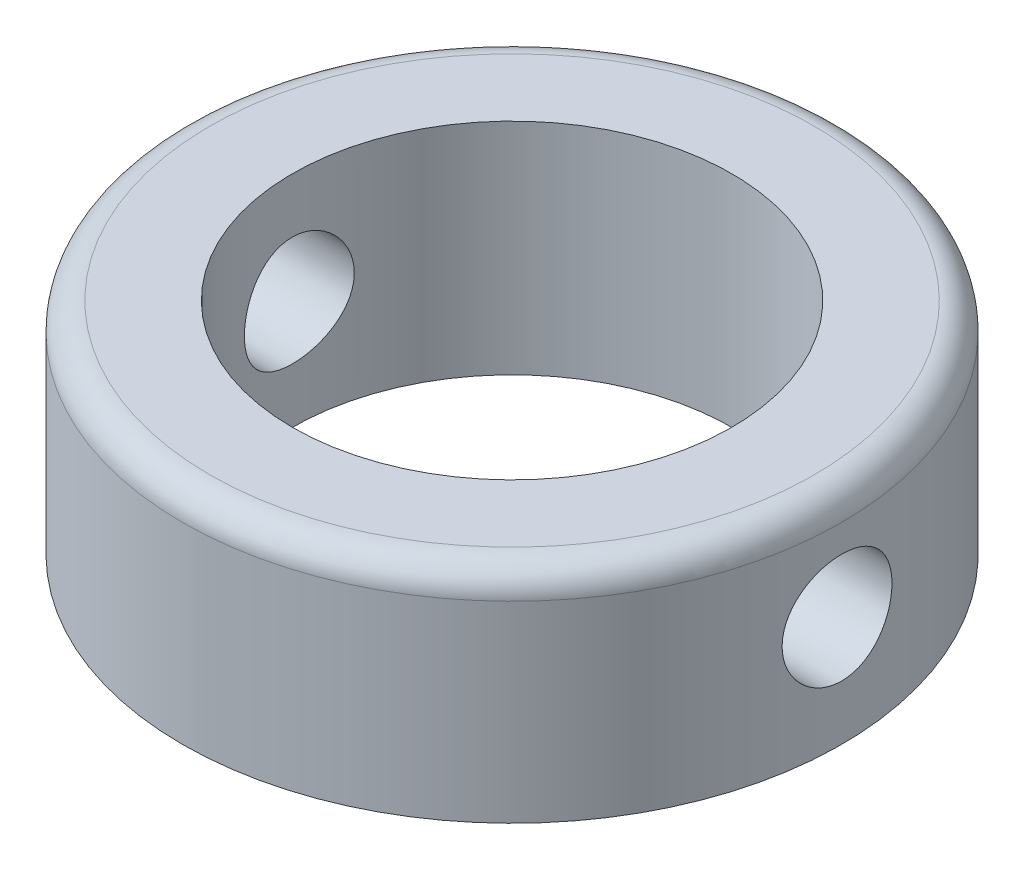
from build123d import *

# Parameters (mm, degrees)
SKETCH1_R               = 12
SKETCH1_R_2             = 8
BOSS_EXTRUDE1_DEPTH     = 4
FILLET1_R               = 1
CUT_EXTRUDE1_DEPTH      = 18.435595774
CUT_EXTRUDE1_DEPTH_BACK = 18.435595774
SKETCH2_R               = 2


with BuildPart() as part:
    # Sketch1 → Boss-Extrude1 (new, symmetric)
    with BuildSketch(Plane(origin=(0, 0, 0), x_dir=(1, 0, 0), z_dir=(0, 1, 0))):
        with Locations(Location((0, 0, 0), (0, 0, 270))):
            Circle(SKETCH1_R)
        with Locations(Location((0, 0, 0), (0, 0, 270))):
            Circle(SKETCH1_R_2, mode=Mode.SUBTRACT)
    extrude(amount=BOSS_EXTRUDE1_DEPTH, both=True)

    # Fillet1
    fillet1_edges = [part.edges().sort_by_distance(p)[0] for p in [
        (0, 4, -12),
    ]]
    fillet(fillet1_edges, radius=FILLET1_R)

    # Sketch2 → Cut-Extrude1 (cut, two sides: drawn at the far end of the back side and taken through both)
    with BuildSketch(Plane(origin=(0, 0, 0), x_dir=(0, 0, -1), z_dir=(1, 0, 0)).offset(-CUT_EXTRUDE1_DEPTH_BACK)):
        Circle(SKETCH2_R)
    extrude(amount=CUT_EXTRUDE1_DEPTH + CUT_EXTRUDE1_DEPTH_BACK, mode=Mode.SUBTRACT)


solid = part.part
